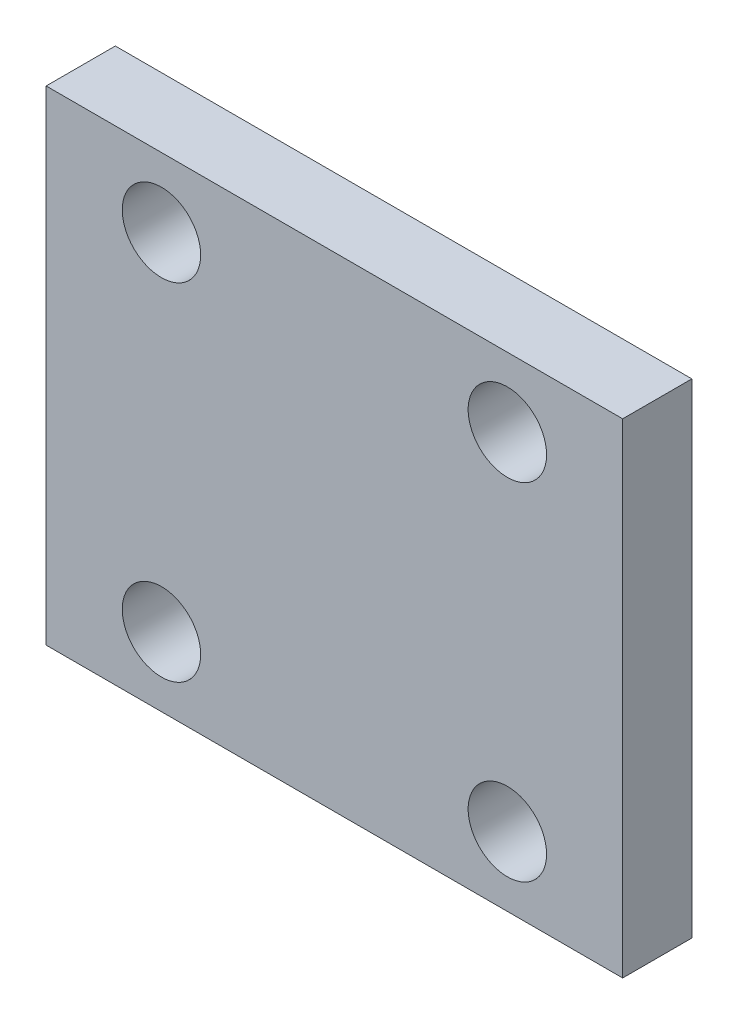
from build123d import *

# Parameters (mm, degrees)
SKETCH_1_W          = 25
SKETCH_1_H          = 21
EXTRUDE_1_DEPTH     = 3
CUT_EXTRUDE_1_REACH = 34.787
SKETCH_2_R          = 1.7


with BuildPart() as part:
    # 草图1 → 凸台-拉伸1 (new body)
    with BuildSketch(Plane.XY):
        with Locations((12.5, 10.5)):
            Rectangle(SKETCH_1_W, SKETCH_1_H)
    extrude(amount=EXTRUDE_1_DEPTH)

    # 草图2 → 切除-拉伸1 (cut, up to next)
    with BuildSketch(Plane.XY.offset(3), mode=Mode.PRIVATE) as cut_extrude_1_sk1:
        with Locations((20, 18)):
            Circle(SKETCH_2_R)
    cut_extrude_1_tool1 = extrude(cut_extrude_1_sk1.sketch, amount=-CUT_EXTRUDE_1_REACH, mode=Mode.PRIVATE) & part.part
    # 草图2 → 切除-拉伸1 (cut, up to next)
    with BuildSketch(Plane.XY.offset(3), mode=Mode.PRIVATE) as cut_extrude_1_sk2:
        with Locations((5, 18)):
            Circle(SKETCH_2_R)
    cut_extrude_1_tool2 = extrude(cut_extrude_1_sk2.sketch, amount=-CUT_EXTRUDE_1_REACH, mode=Mode.PRIVATE) & part.part
    # 草图2 → 切除-拉伸1 (cut, up to next)
    with BuildSketch(Plane.XY.offset(3), mode=Mode.PRIVATE) as cut_extrude_1_sk3:
        with Locations((5, 3)):
            Circle(SKETCH_2_R)
    cut_extrude_1_tool3 = extrude(cut_extrude_1_sk3.sketch, amount=-CUT_EXTRUDE_1_REACH, mode=Mode.PRIVATE) & part.part
    # 草图2 → 切除-拉伸1 (cut, up to next)
    with BuildSketch(Plane.XY.offset(3), mode=Mode.PRIVATE) as cut_extrude_1_sk4:
        with Locations((20, 3)):
            Circle(SKETCH_2_R)
    cut_extrude_1_tool4 = extrude(cut_extrude_1_sk4.sketch, amount=-CUT_EXTRUDE_1_REACH, mode=Mode.PRIVATE) & part.part
    add(cut_extrude_1_tool1.solids().sort_by_distance((20, 18, 3))[0], mode=Mode.SUBTRACT)
    add(cut_extrude_1_tool2.solids().sort_by_distance((5, 18, 3))[0], mode=Mode.SUBTRACT)
    add(cut_extrude_1_tool3.solids().sort_by_distance((5, 3, 3))[0], mode=Mode.SUBTRACT)
    add(cut_extrude_1_tool4.solids().sort_by_distance((20, 3, 3))[0], mode=Mode.SUBTRACT)


solid = part.part
